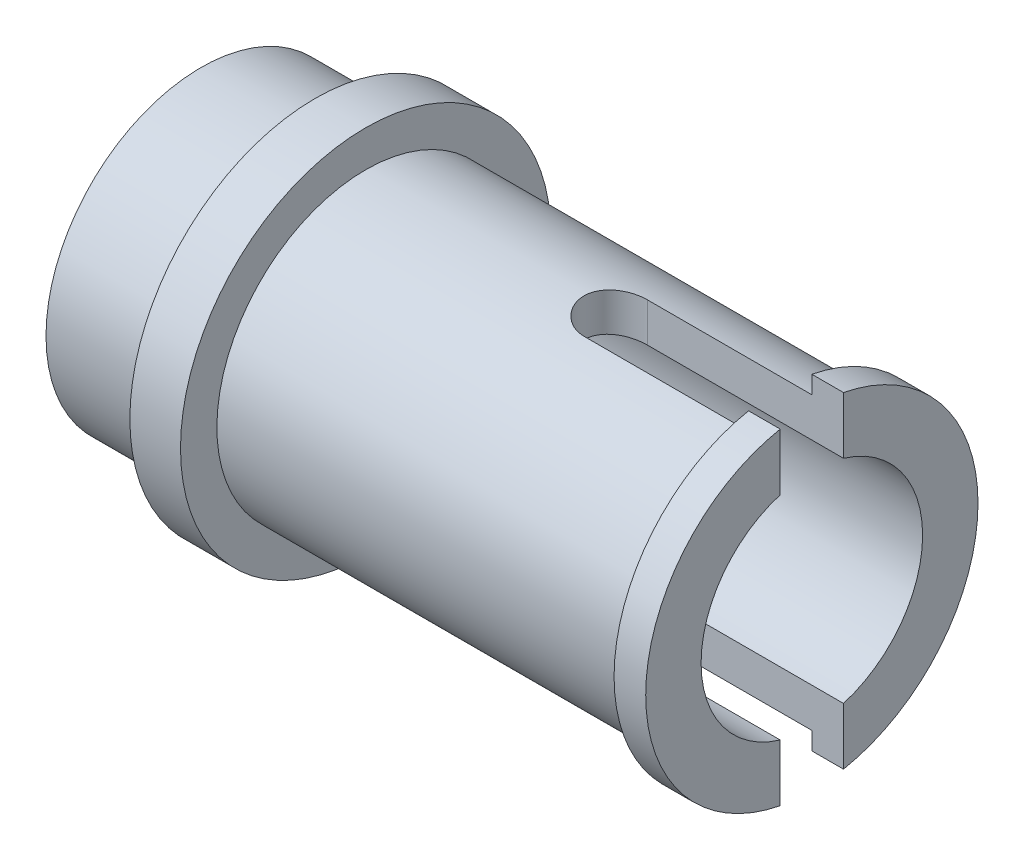
from build123d import *

# Parameters (mm, degrees)
SKETCH1_R             = 2.925
SKETCH1_R_2           = 1.75
MIDDLE_RING_DEPTH     = 0.8
SKETCH2_R             = 2.35
SKETCH2_R_2           = 1.75
OUTER_BODY_DEPTH      = 7.35
SKETCH3_R             = 2.625
SKETCH3_R_2           = 1.75
OUTER_RIM_DEPTH       = 0.5
SIDE_SLOTS_DEPTH      = 9.873204044
SIDE_SLOTS_DEPTH_BACK = 9.873204044
STUD_START            = 1.8
SKETCH6_R             = 2.45
SKETCH6_R_2           = 1.75
STUD_DEPTH            = 1.8


with BuildPart() as part:
    # Sketch1 → Middle Ring (new body)
    with BuildSketch(Plane(origin=(0, 0, 0), x_dir=(0, 0, -1), z_dir=(1, 0, 0))):
        Circle(SKETCH1_R)
        Circle(SKETCH1_R_2, mode=Mode.SUBTRACT)
    extrude(amount=MIDDLE_RING_DEPTH)

    # Sketch2 → Outer Body (add)
    with BuildSketch(Plane(origin=(0, 0, 0), x_dir=(0, 0, -1), z_dir=(1, 0, 0))):
        Circle(SKETCH2_R)
        Circle(SKETCH2_R_2, mode=Mode.SUBTRACT)
    extrude(amount=OUTER_BODY_DEPTH)

    # Sketch3 → Outer Rim (add)
    with BuildSketch(Plane(origin=(7.35, 0, 0), x_dir=(0, 0, -1), z_dir=(1, 0, 0))):
        Circle(SKETCH3_R)
        Circle(SKETCH3_R_2, mode=Mode.SUBTRACT)
    extrude(amount=OUTER_RIM_DEPTH)

    # Sketch5 → Side Slots (cut, two sides: drawn at the far end of the back side and taken through both)
    with BuildSketch(Plane(origin=(0, 0, 0), x_dir=(1, 0, 0), z_dir=(0, 1, 0)).offset(-SIDE_SLOTS_DEPTH_BACK)):
        with BuildLine():
            Line((10.95, -0.5), (4.75, -0.5))
            ThreePointArc((4.75, -0.5), (4.25, 0), (4.75, 0.5))
            Line((4.75, 0.5), (10.95, 0.5))
            ThreePointArc((10.95, 0.5), (11.45, 0), (10.95, -0.5))
        make_face()
        with BuildLine():
            Line((-10.95, -0.5), (-4.75, -0.5))
            ThreePointArc((-4.75, -0.5), (-4.25, 0), (-4.75, 0.5))
            Line((-4.75, 0.5), (-10.95, 0.5))
            ThreePointArc((-10.95, 0.5), (-11.45, 0), (-10.95, -0.5))
        make_face()
    extrude(amount=SIDE_SLOTS_DEPTH + SIDE_SLOTS_DEPTH_BACK, mode=Mode.SUBTRACT)

    # Sketch6 → Stud (add)
    with BuildSketch(Plane.ZY.offset(STUD_START)):
        Circle(SKETCH6_R)
        Circle(SKETCH6_R_2, mode=Mode.SUBTRACT)
    extrude(amount=-STUD_DEPTH)


solid = part.part
